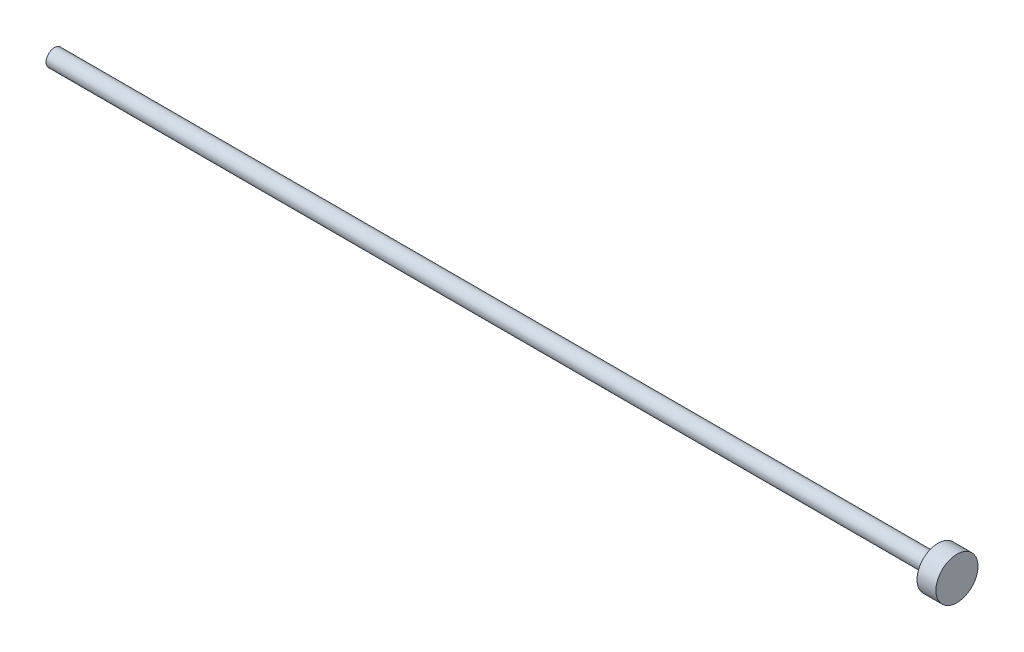
from build123d import *

# Parameters (mm, degrees)
SKETCH_1_R      = 5
EXTRUDE_1_DEPTH = 4.5
SKETCH_2_R      = 2
EXTRUDE_2_DEPTH = 210


with BuildPart() as part:
    # 草图1 → 凸台-拉伸1 (new body)
    with BuildSketch(Plane(origin=(0, 0, 0), x_dir=(0, 0, -1), z_dir=(1, 0, 0))):
        Circle(SKETCH_1_R)
    extrude(amount=EXTRUDE_1_DEPTH)

    # 草图2 → 凸台-拉伸2 (add)
    with BuildSketch(Plane.ZY):
        Circle(SKETCH_2_R)
    extrude(amount=EXTRUDE_2_DEPTH)


solid = part.part
